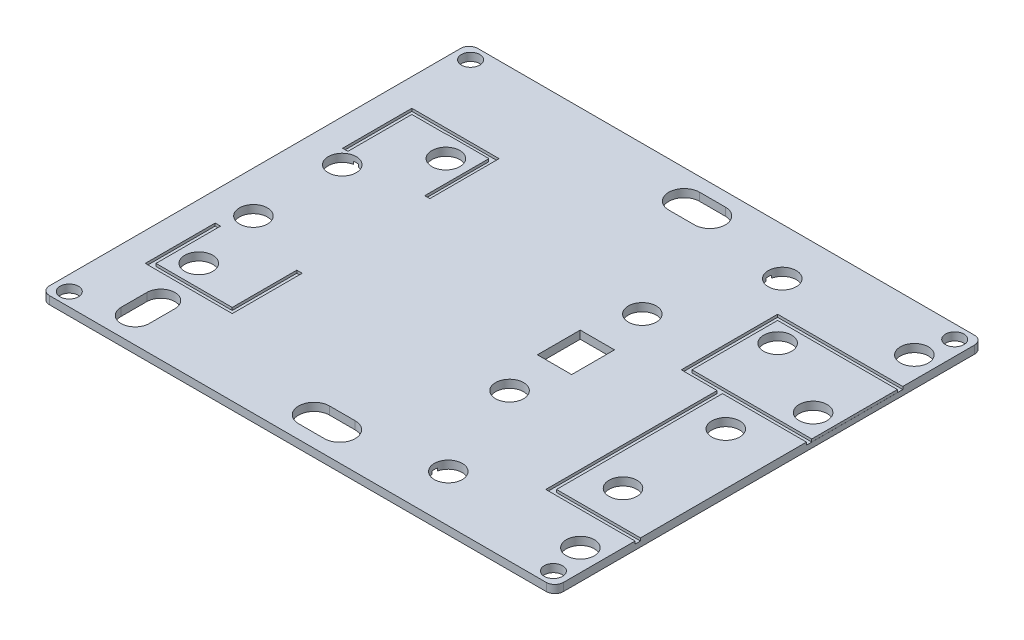
from build123d import *

# Parameters (mm, degrees)
SKETCH1_W               = 152.4
SKETCH1_H               = 127
BOSS_EXTRUDE1_DEPTH     = 2.3622
FILLET1_R               = 2.54
SKETCH9_R               = 4.15
CUT_EXTRUDE8_DEPTH      = 100.218294628
CUT_EXTRUDE11_DEPTH     = 100.218294628
CUT_EXTRUDE12_DEPTH     = 100.218294628
SKETCH16_R              = 4.15
CUT_EXTRUDE14_DEPTH     = 100.218294628
SKETCH17_R              = 2.7305
CUT_EXTRUDE16_DEPTH     = 100.218294628
MIRROR7_COPY_1_SKETCH_R = 2.7305
MIRROR7_COPY_1_DEPTH    = 100.218294628
SKETCH26_W              = 10.16
SKETCH26_H              = 12.7
CUT_EXTRUDE26_DEPTH     = 100.218294628
SKETCH27_R              = 4.15
CUT_EXTRUDE27_DEPTH     = 100.218294628
SKETCH29_R              = 4.15
CUT_EXTRUDE28_DEPTH     = 100.218294628
SKETCH30_R              = 4.15
CUT_EXTRUDE29_DEPTH     = 100.218294628
SKETCH31_R              = 4.15
CUT_EXTRUDE30_DEPTH     = 100.218294628
CUT_EXTRUDE31_DEPTH     = 0.79375
SKETCH33_W              = 1.5875
SKETCH33_H              = 1.5875
CUT_EXTRUDE32_DEPTH     = 0.79375
SKETCH34_W              = 24.632574661
SKETCH34_H              = 37.675
SKETCH34_W_2            = 21.457574661
SKETCH34_H_2            = 34.5
CUT_EXTRUDE33_DEPTH     = 0.79375
CUT_EXTRUDE34_START     = -0.79375
CUT_EXTRUDE34_DEPTH     = 0.79375


with BuildPart() as part:
    # Sketch1 → Boss-Extrude1 (new body)
    with BuildSketch(Plane(origin=(0, 0, 0), x_dir=(1, 0, 0), z_dir=(0, 1, 0))):
        Rectangle(SKETCH1_W, SKETCH1_H)
    extrude(amount=BOSS_EXTRUDE1_DEPTH)

    # Fillet1
    fillet1_edges = [part.edges().sort_by_distance(p)[0] for p in [
        (76.2, 1.1811, 63.5),
        (-76.2, 1.1811, 63.5),
        (-76.2, 1.1811, -63.5),
        (76.2, 1.1811, -63.5),
    ]]
    fillet(fillet1_edges, radius=FILLET1_R)

    # Sketch9 → Cut-Extrude8 (cut, through all)
    with BuildSketch(Plane.XZ):
        with Locations(Location((60.8584, 27.94, 0), (0, 0, 270))):
            Circle(SKETCH9_R)
        with Locations(Location((60.8584, -2.54, 0), (0, 0, 270))):
            Circle(SKETCH9_R)
    extrude(amount=-CUT_EXTRUDE8_DEPTH, mode=Mode.SUBTRACT)

    # Sketch12 → Cut-Extrude11 (cut, through all)
    with BuildSketch(Plane.XZ):
        with BuildLine():
            Line((-3.81, 59.465627528), (3.81, 59.465627528))
            ThreePointArc((3.81, 59.465627528), (8.387405636, 54.888221892), (3.81, 50.310816255))
            Line((3.81, 50.310816255), (-3.81, 50.310816255))
            ThreePointArc((-3.81, 50.310816255), (-8.387405636, 54.888221892), (-3.81, 59.465627528))
        make_face()
    cut_extrude11 = extrude(amount=-CUT_EXTRUDE11_DEPTH, mode=Mode.SUBTRACT)

    # Mirror3: Cut-Extrude11 across plane
    add(cut_extrude11.mirror(Plane.XY), mode=Mode.SUBTRACT)

    # Sketch13 → Cut-Extrude12 (cut, through all)
    with BuildSketch(Plane(origin=(0, 0, 0), x_dir=(-1, 0, 0), z_dir=(0, -1, 0))):
        with BuildLine():
            Line((60.052874771, -48.26), (60.052874771, -55.88))
            ThreePointArc((60.052874771, -55.88), (55.88, -60.052874771), (51.707125229, -55.88))
            Line((51.707125229, -55.88), (51.707125229, -48.26))
            ThreePointArc((51.707125229, -48.26), (55.88, -44.087125229), (60.052874771, -48.26))
        make_face()
    extrude(amount=-CUT_EXTRUDE12_DEPTH, mode=Mode.SUBTRACT)

    # Sketch16 → Cut-Extrude14 (cut, through all)
    with BuildSketch(Plane(origin=(0, 0, 0), x_dir=(-1, 0, 0), z_dir=(0, -1, 0))):
        with Locations(Location((-69.599893995, 19.704320306, 0), (0, 0, 90))):
            Circle(SKETCH16_R)
        with Locations(Location((-46.522565834, 32.264238523, 0), (0, 0, 90))):
            Circle(SKETCH16_R)
    extrude(amount=-CUT_EXTRUDE14_DEPTH, mode=Mode.SUBTRACT)

    # Sketch17 → Cut-Extrude16 (cut, through all)
    with BuildSketch(Plane.XZ):
        with Locations(Location((71.794813785, 59.510435834, 0), (0, 0, 270))):
            Circle(SKETCH17_R)
    cut_extrude16 = extrude(amount=-CUT_EXTRUDE16_DEPTH, mode=Mode.SUBTRACT)

    # Mirror6: Cut-Extrude16 across plane
    add(cut_extrude16.mirror(Plane(origin=(0, 0, 0), x_dir=(0, 0, 1), z_dir=(1, 0, 0))), mode=Mode.SUBTRACT)

    # Mirror7: Cut-Extrude16 across plane
    add(cut_extrude16.mirror(Plane.XY), mode=Mode.SUBTRACT)

    # Mirror7 copy 1 sketch → Mirror7 copy 1 (cut, through all)
    with BuildSketch(Plane(origin=(0, 0, 0), x_dir=(-1, 0, 0), z_dir=(0, -1, 0))):
        with Locations(Location((71.794813785, 59.510435834, 0), (0, 0, 270))):
            Circle(MIRROR7_COPY_1_SKETCH_R)
    extrude(amount=-MIRROR7_COPY_1_DEPTH, mode=Mode.SUBTRACT)

    # Sketch26 → Cut-Extrude26 (cut, through all)
    with BuildSketch(Plane(origin=(0, 2.3622, 0), x_dir=(1, 0, 0), z_dir=(0, 1, 0))):
        with Locations((18.964621702, 0)):
            Rectangle(SKETCH26_W, SKETCH26_H)
    extrude(amount=-CUT_EXTRUDE26_DEPTH, mode=Mode.SUBTRACT)

    # Sketch27 → Cut-Extrude27 (cut, through all)
    with BuildSketch(Plane.XZ):
        with Locations(Location((-59.831398438, 33.060447312, 0), (0, 0, 270))):
            Circle(SKETCH27_R)
        with Locations(Location((-50.09170874, -30.48, 0), (0, 0, 270))):
            Circle(SKETCH27_R)
    extrude(amount=-CUT_EXTRUDE27_DEPTH, mode=Mode.SUBTRACT)

    # Sketch29 → Cut-Extrude28 (cut, through all)
    with BuildSketch(Plane(origin=(0, 2.3622, 0), x_dir=(1, 0, 0), z_dir=(0, 1, 0))):
        with Locations(Location((18.964621702, 19.681240592, 0), (0, 0, 270))):
            Circle(SKETCH29_R)
        with Locations(Location((18.964621702, -19.681240592, 0), (0, 0, 270))):
            Circle(SKETCH29_R)
    extrude(amount=-CUT_EXTRUDE28_DEPTH, mode=Mode.SUBTRACT)

    # Sketch30 → Cut-Extrude29 (cut, through all)
    with BuildSketch(Plane(origin=(0, 2.3622, 0), x_dir=(1, 0, 0), z_dir=(0, 1, 0))):
        with Locations(Location((69.803274088, -49.53, 0), (0, 0, 270))):
            Circle(SKETCH30_R)
        with Locations(Location((30.63517528, -49.53, 0), (0, 0, 270))):
            Circle(SKETCH30_R)
    cut_extrude29 = extrude(amount=-CUT_EXTRUDE29_DEPTH, mode=Mode.SUBTRACT)

    # Mirror8: Cut-Extrude29 across plane
    add(cut_extrude29.mirror(Plane.XY), mode=Mode.SUBTRACT)

    # Sketch31 → Cut-Extrude30 (cut, through all)
    with BuildSketch(Plane(origin=(0, 2.3622, 0), x_dir=(1, 0, 0), z_dir=(0, 1, 0))):
        with Locations(Location((-63.894835235, -12.79551579, 0), (0, 0, 270))):
            Circle(SKETCH31_R)
        with Locations(Location((-63.894835235, 13.549600091, 0), (0, 0, 270))):
            Circle(SKETCH31_R)
    extrude(amount=-CUT_EXTRUDE30_DEPTH, mode=Mode.SUBTRACT)

    # Sketch32 → Cut-Extrude31 (cut)
    with BuildSketch(Plane(origin=(0, 2.3622, 0), x_dir=(1, 0, 0), z_dir=(0, 1, 0))):
        Polygon((-66.467594082, 36.762943521), (-56.233474354, 36.762943521), (-56.233474354, 36.855969312), (-43.767784695, 36.855969312), (-43.767784695, 36.762943521), (-43.689716795, 36.762943521), (-43.689716795, 17.806129276), (-42.180284695, 17.806129276), (-42.180284695, 38.350443521), (-68.055094082, 38.350443521), (-68.055094082, 17.806129276), (-66.467594082, 17.806129276), align=None)
        Polygon((-43.533580996, -39.436416624), (-66.155322484, -39.436416624), (-66.155322484, -20.293550797), (-67.742822484, -20.293550797), (-67.742822484, -41.023916624), (-41.946080996, -41.023916624), (-41.946080996, -20.293550797), (-43.533580996, -20.293550797), align=None)
    extrude(amount=-CUT_EXTRUDE31_DEPTH, mode=Mode.SUBTRACT)

    # Sketch33 → Cut-Extrude32 (cut)
    with BuildSketch(Plane(origin=(0, 2.3622, 0), x_dir=(1, 0, 0), z_dir=(0, 1, 0))):
        Polygon((51.297781708, 11.125983721), (49.710281708, 11.125983721), (49.710281708, -39.6875), (76.2, -39.6875), (76.2, -38.1), (51.297781708, -38.1), align=None)
        Polygon((76.184917735, 12.713483721), (51.297781708, 12.713483721), (51.297781708, 11.125983721), (76.2, 11.125983721), (76.2, 14.063999978), (76.184917735, 14.063999978), align=None)
        with Locations((50.504031708, 11.919733721)):
            Rectangle(SKETCH33_W, SKETCH33_H)
        Polygon((49.710281708, 12.713483721), (40.669704347, 12.713483721), (40.669704347, 38.10435014), (76.184917735, 38.10435014), (76.184917735, 14.063999978), (76.2, 14.063999978), (76.2, 39.69185014), (39.082204347, 39.69185014), (39.082204347, 11.125983721), (49.710281708, 11.125983721), align=None)
    extrude(amount=-CUT_EXTRUDE32_DEPTH, mode=Mode.SUBTRACT)

    # Sketch34 → Cut-Extrude33 (cut)
    with BuildSketch(Plane.XZ):
        with Locations((-63.883712669, -0.37704215)):
            Rectangle(SKETCH34_W, SKETCH34_H)
        with Locations((-63.88371267, -0.37704215)):
            Rectangle(SKETCH34_W_2, SKETCH34_H_2, mode=Mode.SUBTRACT)
    extrude(amount=-CUT_EXTRUDE33_DEPTH, mode=Mode.SUBTRACT)

    # Sketch36 → Cut-Extrude34 (cut)
    with BuildSketch(Plane.XZ.offset(CUT_EXTRUDE34_START)):
        with BuildLine():
            Line((75.27317528, 44.45), (26.57117528, 44.45))
            Line((26.57117528, 44.45), (26.57117528, 48.689521566))
            ThreePointArc((26.57117528, 48.689521566), (26.48517528, 49.53), (26.57117528, 50.370478434))
            Line((26.57117528, 50.370478434), (26.57117528, 54.61))
            Line((26.57117528, 54.61), (75.27317528, 54.61))
            Line((75.27317528, 54.61), (75.27317528, 56.1975))
            Line((75.27317528, 56.1975), (24.98367528, 56.1975))
            Line((24.98367528, 56.1975), (24.98367528, 42.8625))
            Line((24.98367528, 42.8625), (75.27317528, 42.8625))
            Line((75.27317528, 42.8625), (75.27317528, 44.45))
        make_face()
    cut_extrude34 = extrude(amount=CUT_EXTRUDE34_DEPTH, mode=Mode.SUBTRACT)

    # Mirror9: Cut-Extrude34 across plane
    add(cut_extrude34.mirror(Plane.XY), mode=Mode.SUBTRACT)


solid = part.part
